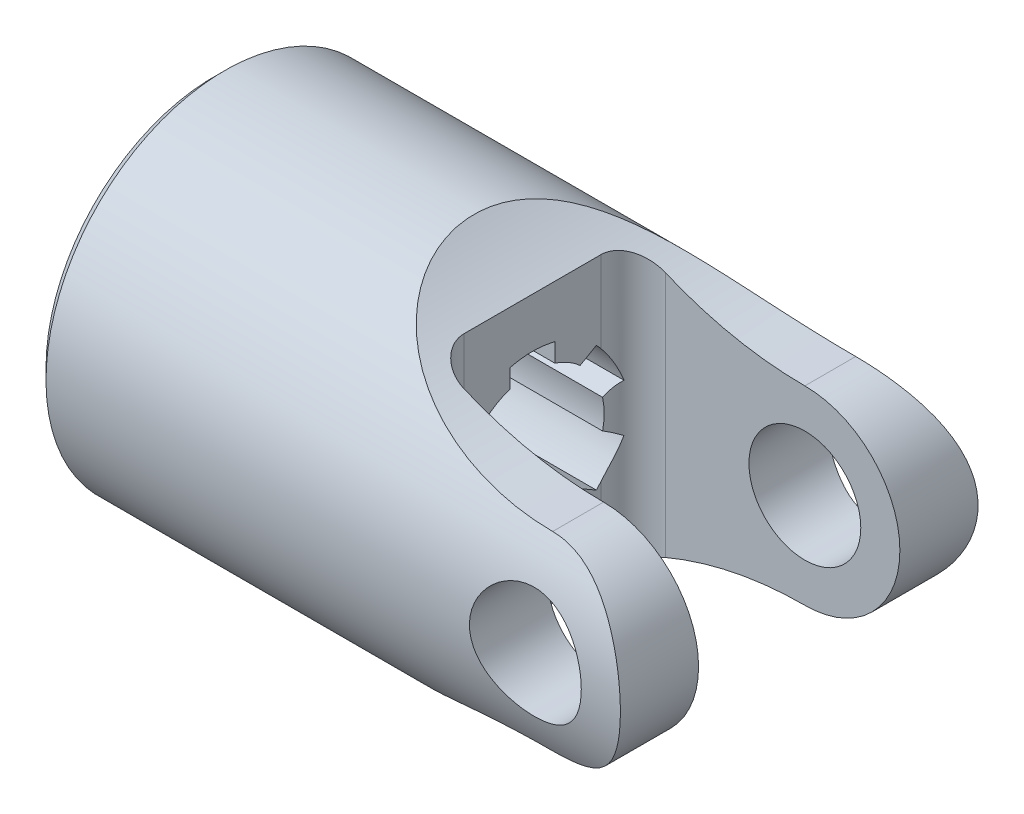
from build123d import *

# Parameters (mm, degrees)
SKETCH1_R           = 25.4
BOSS_EXTRUDE1_DEPTH = 83.08975
CUT_EXTRUDE1_DEPTH  = 43.688
SKETCH5_R           = 7.94258
CUT_EXTRUDE2_DEPTH  = 43.688
SKETCH6_W           = 13.49375
SKETCH6_H           = 14.29385
CUT_EXTRUDE3_DEPTH  = 43.688
CHAMFER1_SIZE       = 1.524
SKETCH8_R           = 10.16
CUT_EXTRUDE4_DEPTH  = 91.521967399
CUT_EXTRUDE5_DEPTH  = 91.521967399
CIRPATTERN1_COUNT   = 6


with BuildPart() as part:
    # Sketch1 → Boss-Extrude1 (new body)
    with BuildSketch(Plane(origin=(0, 0, 0), x_dir=(0, 0, -1), z_dir=(1, 0, 0))):
        Circle(SKETCH1_R)
    extrude(amount=BOSS_EXTRUDE1_DEPTH)

    # Sketch4 → Cut-Extrude1 (cut, symmetric)
    with BuildSketch(Plane.XY):
        with BuildLine():
            ThreePointArc((69.596, 13.49375), (79.137522129, 9.541522129), (83.08975, 0))
            Line((83.08975, 0), (83.08975, 25.4))
            Line((83.08975, 25.4), (36.9170127, 25.4))
            ThreePointArc((36.9170127, 25.4), (52.205808799, 16.563033999), (69.596, 13.49375))
        make_face()
        with BuildLine():
            Line((36.9170127, -25.4), (83.08975, -25.4))
            Line((83.08975, -25.4), (83.08975, 0))
            ThreePointArc((83.08975, 0), (79.137522129, -9.541522129), (69.596, -13.49375))
            ThreePointArc((69.596, -13.49375), (52.205808799, -16.563033999), (36.9170127, -25.4))
        make_face()
    extrude(amount=CUT_EXTRUDE1_DEPTH, both=True, mode=Mode.SUBTRACT)

    # Sketch5 → Cut-Extrude2 (cut, symmetric)
    with BuildSketch(Plane.XY):
        with Locations((69.596, 0)):
            Circle(SKETCH5_R)
    extrude(amount=CUT_EXTRUDE2_DEPTH, both=True, mode=Mode.SUBTRACT)

    # Sketch6 → Cut-Extrude3 (cut, symmetric)
    with BuildSketch(Plane(origin=(0, 0, 0), x_dir=(1, 0, 0), z_dir=(0, 1, 0))):
        with BuildLine():
            Line((69.596, 0), (69.596, 14.29385))
            Line((69.596, 14.29385), (49.784, 14.29385))
            ThreePointArc((49.784, 14.29385), (46.551107796, 12.954742204), (45.212, 9.72185))
            Line((45.212, 9.72185), (45.212, 0))
            Line((45.212, 0), (69.596, 0))
        make_face()
        with BuildLine():
            Line((69.596, -14.29385), (69.596, 0))
            Line((69.596, 0), (45.212, 0))
            Line((45.212, 0), (45.212, -9.72185))
            ThreePointArc((45.212, -9.72185), (46.551107796, -12.954742204), (49.784, -14.29385))
            Line((49.784, -14.29385), (69.596, -14.29385))
        make_face()
        with Locations((76.342875, -7.146925)):
            Rectangle(SKETCH6_W, SKETCH6_H)
        with Locations((76.342875, 7.146925)):
            Rectangle(SKETCH6_W, SKETCH6_H)
    extrude(amount=CUT_EXTRUDE3_DEPTH, both=True, mode=Mode.SUBTRACT)

    # Chamfer1
    chamfer1_edges = [part.edges().sort_by_distance(p)[0] for p in [
        (0, 0, 25.4),
    ]]
    chamfer(chamfer1_edges, length=CHAMFER1_SIZE)

    # Sketch8 → Cut-Extrude4 (cut, through all)
    with BuildSketch(Plane.ZY):
        Circle(SKETCH8_R)
    extrude(amount=-CUT_EXTRUDE4_DEPTH, mode=Mode.SUBTRACT)

    # Sketch7 → Cut-Extrude5 (cut, through all)
    with BuildSketch(Plane.ZY):
        with BuildLine():
            Line((-3.175, 9.651164438), (-3.175, 12.296722124))
            ThreePointArc((-3.175, 12.296722124), (0, 12.7), (3.175, 12.296722124))
            Line((3.175, 12.296722124), (3.175, 9.651164438))
            ThreePointArc((3.175, 9.651164438), (0, 10.16), (-3.175, 9.651164438))
        make_face()
    cut_extrude5 = extrude(amount=-CUT_EXTRUDE5_DEPTH, mode=Mode.SUBTRACT)

    # CirPattern1: Cut-Extrude5 ×6 about axis
    cirpattern1_axis = Axis((0, 0, 0), (1, 0, 0))
    for i in range(1, CIRPATTERN1_COUNT):
        add(cut_extrude5.rotate(cirpattern1_axis, i * 360 / CIRPATTERN1_COUNT), mode=Mode.SUBTRACT)


solid = part.part
